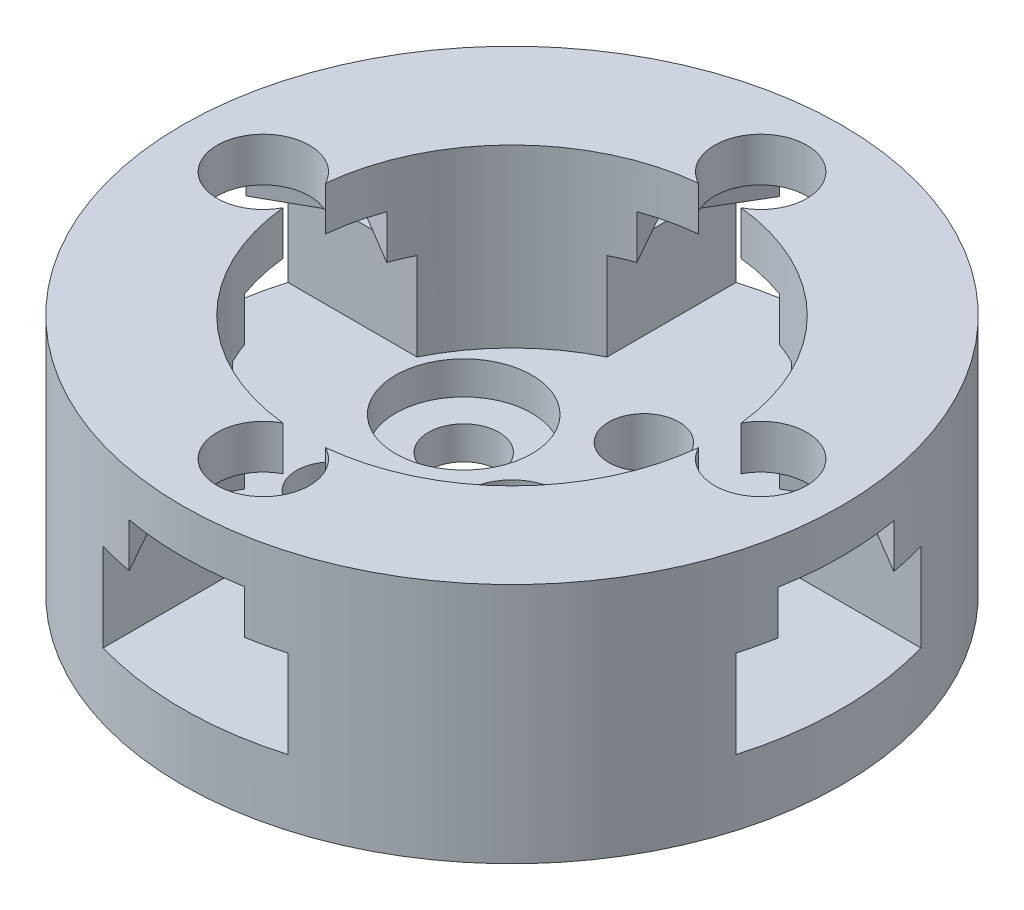
from build123d import *

# Parameters (mm, degrees)
SKETCH1_R           = 10
SKETCH1_R_2         = 1.6
SKETCH1_R_3         = 2.15
BOSS_EXTRUDE1_DEPTH = 3
SKETCH2_R           = 3.1
CUT_EXTRUDE2_DEPTH  = 1.5
SKETCH3_R           = 15
SKETCH3_R_2         = 9.5
BOSS_EXTRUDE2_DEPTH = 11
SKETCH5_R           = 2.1
CUT_EXTRUDE3_DEPTH  = 4
SKETCH7_W           = 10
SKETCH7_H           = 8.4
SKETCH7_W_2         = 8.4
SKETCH7_H_2         = 10
CUT_EXTRUDE4_DEPTH  = 4
CUT_EXTRUDE6_DEPTH  = 2


with BuildPart() as part:
    # Sketch1 → Boss-Extrude1 (new body)
    with BuildSketch(Plane(origin=(0, 0, 0), x_dir=(1, 0, 0), z_dir=(0, 1, 0))):
        with Locations(Location((0, 0, 0), (0, 0, 270))):
            Circle(SKETCH1_R)
        with Locations(Location((0, 6, 0), (0, 0, 270))):
            Circle(SKETCH1_R_2, mode=Mode.SUBTRACT)
        with Locations(Location((5.196152423, 3, 0), (0, 0, 270))):
            Circle(SKETCH1_R_2, mode=Mode.SUBTRACT)
        with Locations(Location((5.196152423, -3, 0), (0, 0, 270))):
            Circle(SKETCH1_R_2, mode=Mode.SUBTRACT)
        with Locations(Location((0, -6, 0), (0, 0, 270))):
            Circle(SKETCH1_R_2, mode=Mode.SUBTRACT)
        with Locations(Location((-5.196152423, -3, 0), (0, 0, 270))):
            Circle(SKETCH1_R_2, mode=Mode.SUBTRACT)
        with Locations(Location((-5.196152423, 3, 0), (0, 0, 270))):
            Circle(SKETCH1_R_2, mode=Mode.SUBTRACT)
        with Locations(Location((0, 0, 0), (0, 0, 270))):
            Circle(SKETCH1_R_3, mode=Mode.SUBTRACT)
    extrude(amount=BOSS_EXTRUDE1_DEPTH)

    # Sketch2 → Cut-Extrude2 (cut)
    with BuildSketch(Plane(origin=(0, 3, 0), x_dir=(1, 0, 0), z_dir=(0, 1, 0))):
        with Locations(Location((-5.196152423, 3, 0), (0, 0, 270))):
            Circle(SKETCH2_R)
        with Locations(Location((5.196152423, -3, 0), (0, 0, 270))):
            Circle(SKETCH2_R)
    extrude(amount=-CUT_EXTRUDE2_DEPTH, mode=Mode.SUBTRACT)

    # Sketch3 → Boss-Extrude2 (add)
    with BuildSketch(Plane.XZ):
        with Locations(Location((0, 0, 0), (0, 0, 270))):
            Circle(SKETCH3_R)
        with Locations(Location((0, 0, 0), (0, 0, 270))):
            Circle(SKETCH3_R_2, mode=Mode.SUBTRACT)
    extrude(amount=-BOSS_EXTRUDE2_DEPTH)

    # Sketch5 → Cut-Extrude3 (cut)
    with BuildSketch(Plane(origin=(0, 11, 0), x_dir=(1, 0, 0), z_dir=(0, 1, 0))):
        with Locations((0, 11.313708499)):
            Circle(SKETCH5_R)
        with Locations((11.313708499, 0)):
            Circle(SKETCH5_R)
        with Locations((0, -11.313708499)):
            Circle(SKETCH5_R)
        with Locations((-11.313708499, 0)):
            Circle(SKETCH5_R)
    extrude(amount=-CUT_EXTRUDE3_DEPTH, mode=Mode.SUBTRACT)

    # Sketch7 → Cut-Extrude4 (cut)
    with BuildSketch(Plane(origin=(0, 7, 0), x_dir=(1, 0, 0), z_dir=(0, 1, 0))):
        with Locations((-12.313708499, 0)):
            Rectangle(SKETCH7_W, SKETCH7_H)
        with Locations((0, 12.313708499)):
            Rectangle(SKETCH7_W_2, SKETCH7_H_2)
        with Locations((12.313708499, 0)):
            Rectangle(SKETCH7_W, SKETCH7_H)
        with Locations((0, -12.313708499)):
            Rectangle(SKETCH7_W_2, SKETCH7_H_2)
    extrude(amount=-CUT_EXTRUDE4_DEPTH, mode=Mode.SUBTRACT)

    # Sketch8 → Cut-Extrude6 (cut)
    with BuildSketch(Plane.XZ.offset(-7)):
        Polygon((-2.257631932, 7.284262955), (2.360786238, 7.343819121), (4.61841817, 11.373264666), (2.257631932, 15.343154043), (-2.360786238, 15.283597877), (-4.61841817, 11.254152332), align=None)
        Polygon((-7.284262955, -2.257631932), (-7.343819121, 2.360786238), (-11.373264666, 4.61841817), (-15.343154043, 2.257631932), (-15.283597877, -2.360786238), (-11.254152332, -4.61841817), align=None)
        Polygon((7.284262955, 2.257631932), (7.343819121, -2.360786238), (11.373264666, -4.61841817), (15.343154043, -2.257631932), (15.283597877, 2.360786238), (11.254152332, 4.61841817), align=None)
        Polygon((2.257631932, -7.284262955), (-2.360786238, -7.343819121), (-4.61841817, -11.373264666), (-2.257631932, -15.343154043), (2.360786238, -15.283597877), (4.61841817, -11.254152332), align=None)
    extrude(amount=-CUT_EXTRUDE6_DEPTH, mode=Mode.SUBTRACT)


solid = part.part
